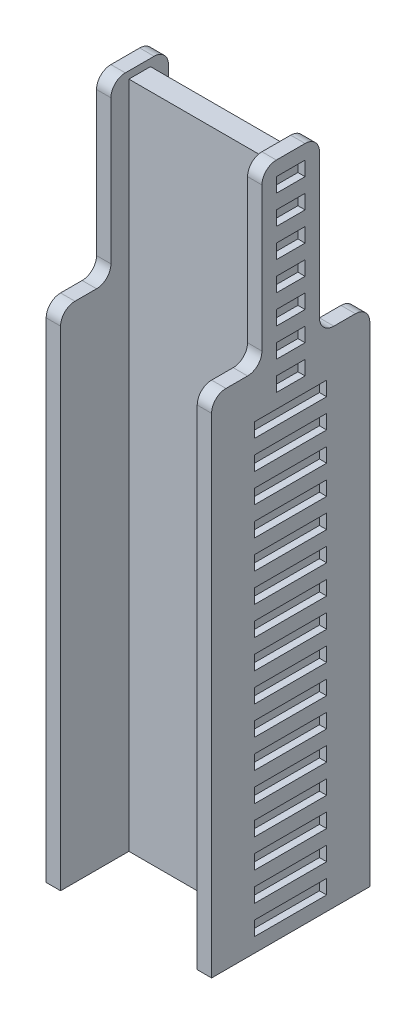
from build123d import *

# Parameters (mm, degrees)
BOSS_EXTRUDE1_DEPTH = 12
SKETCH3_W           = 9.5
SKETCH3_H           = 1.5
CUT_EXTRUDE1_DEPTH  = 0.5
BOSS_EXTRUDE2_DEPTH = 5
FILLET1_R           = 1
BOSS_EXTRUDE3_DEPTH = 30
SKETCH6_W           = 5
SKETCH6_H           = 1
SKETCH6_W_2         = 2
CUT_EXTRUDE2_DEPTH  = 0.5


with BuildPart() as part:
    # Sketch2 → Boss-Extrude1 (new body)
    with BuildSketch(Plane(origin=(0, 0, 0), x_dir=(1, 0, 0), z_dir=(0, 1, 0))):
        Polygon((-5.75, 1.25), (-5.75, -2.75), (-4.75, -2.75), (-4.75, -1.5), (4.75, -1.5), (4.75, -2.75), (5.75, -2.75), (5.75, 1.25), (4.75, 1.25), (4.75, 0), (-4.75, 0), (-4.75, 1.25), align=None)
    extrude(amount=BOSS_EXTRUDE1_DEPTH)

    # Sketch3 → Cut-Extrude1 (cut)
    with BuildSketch(Plane(origin=(0, 12, 0), x_dir=(1, 0, 0), z_dir=(0, 1, 0))):
        with Locations((0, -0.75)):
            Rectangle(SKETCH3_W, SKETCH3_H)
    extrude(amount=-CUT_EXTRUDE1_DEPTH, mode=Mode.SUBTRACT)

    # Sketch4 → Boss-Extrude2 (add)
    with BuildSketch(Plane.XZ):
        Polygon((4.75, 0), (-4.75, 0), (-4.75, -4.75), (-5.75, -4.75), (-5.75, 6.25), (-4.75, 6.25), (-4.75, 1.5), (4.75, 1.5), (4.75, 6.25), (5.75, 6.25), (5.75, -4.75), (4.75, -4.75), align=None)
    extrude(amount=BOSS_EXTRUDE2_DEPTH)

    # Fillet1
    fillet1_edges = [part.edges().sort_by_distance(p)[0] for p in [
        (-5.25, 12, 2.75),
        (5.25, 0, -1.25),
        (5.25, 0, 2.75),
        (-5.25, 0, 2.75),
        (-5.25, 0, -1.25),
        (5.25, 12, 2.75),
        (5.25, 12, -1.25),
        (-5.25, 12, -1.25),
        (5.25, 0, -4.75),
        (5.25, 0, 6.25),
        (-5.25, 0, 6.25),
        (-5.25, 0, -4.75),
    ]]
    fillet(fillet1_edges, radius=FILLET1_R)

    # Sketch5 → Boss-Extrude3 (add)
    with BuildSketch(Plane.XZ.offset(5)):
        Polygon((4.75, 0), (4.75, -4.75), (5.75, -4.75), (5.75, 6.25), (4.75, 6.25), (4.75, 1.5), (-4.75, 1.5), (-4.75, 6.25), (-5.75, 6.25), (-5.75, -4.75), (-4.75, -4.75), (-4.75, 0), align=None)
    extrude(amount=BOSS_EXTRUDE3_DEPTH)

    # Sketch6 → Cut-Extrude2 (cut)
    with BuildSketch(Plane.ZY.offset(5.75)):
        with Locations((0.75, -3.5)):
            Rectangle(SKETCH6_W, SKETCH6_H)
        with Locations((0.75, -5.5)):
            Rectangle(SKETCH6_W, SKETCH6_H)
        with Locations((0.75, -7.5)):
            Rectangle(SKETCH6_W, SKETCH6_H)
        with Locations((0.75, -9.5)):
            Rectangle(SKETCH6_W, SKETCH6_H)
        with Locations((0.75, -11.5)):
            Rectangle(SKETCH6_W, SKETCH6_H)
        with Locations((0.75, -13.5)):
            Rectangle(SKETCH6_W, SKETCH6_H)
        with Locations((0.75, -15.5)):
            Rectangle(SKETCH6_W, SKETCH6_H)
        with Locations((0.75, -17.5)):
            Rectangle(SKETCH6_W, SKETCH6_H)
        with Locations((0.75, -19.5)):
            Rectangle(SKETCH6_W, SKETCH6_H)
        with Locations((0.75, -21.5)):
            Rectangle(SKETCH6_W, SKETCH6_H)
        with Locations((0.75, -23.5)):
            Rectangle(SKETCH6_W, SKETCH6_H)
        with Locations((0.75, -25.5)):
            Rectangle(SKETCH6_W, SKETCH6_H)
        with Locations((0.75, -27.5)):
            Rectangle(SKETCH6_W, SKETCH6_H)
        with Locations((0.75, -29.5)):
            Rectangle(SKETCH6_W, SKETCH6_H)
        with Locations((0.75, -31.5)):
            Rectangle(SKETCH6_W, SKETCH6_H)
        with Locations((0.75, -33.5)):
            Rectangle(SKETCH6_W, SKETCH6_H)
        with Locations((0.75, 0.5)):
            Rectangle(SKETCH6_W_2, SKETCH6_H)
        with Locations((0.75, -1.5)):
            Rectangle(SKETCH6_W_2, SKETCH6_H)
        with Locations((0.75, 2.5)):
            Rectangle(SKETCH6_W_2, SKETCH6_H)
        with Locations((0.75, 4.5)):
            Rectangle(SKETCH6_W_2, SKETCH6_H)
        with Locations((0.75, 6.5)):
            Rectangle(SKETCH6_W_2, SKETCH6_H)
        with Locations((0.75, 8.5)):
            Rectangle(SKETCH6_W_2, SKETCH6_H)
        with Locations((0.75, 10.5)):
            Rectangle(SKETCH6_W_2, SKETCH6_H)
    cut_extrude2 = extrude(amount=-CUT_EXTRUDE2_DEPTH, mode=Mode.SUBTRACT)

    # Mirror1: Cut-Extrude2 across plane
    add(cut_extrude2.mirror(Plane(origin=(0, 0, 0), x_dir=(0, 0, 1), z_dir=(1, 0, 0))), mode=Mode.SUBTRACT)


solid = part.part
